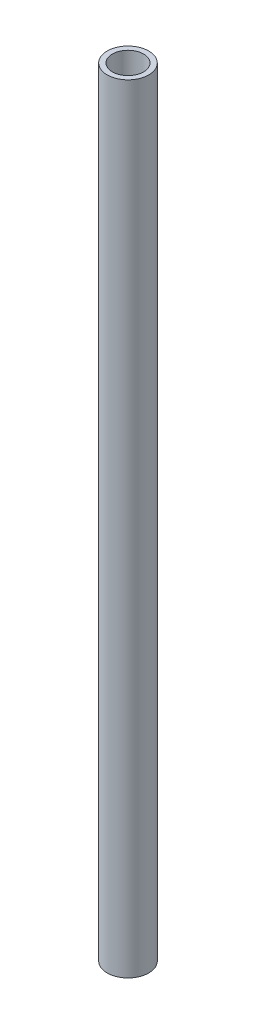
from build123d import *

# Parameters (mm, degrees)
SKETCH2_R   = 4
SKETCH2_R_2 = 3


with BuildPart() as part:
    # Sweep1: sweep along a path in Sketch1
    with BuildLine(Plane.XY) as sweep1_path:
        Line((0, 0), (0, 150))
    # Sketch2 → Sweep1 (sweep)
    with BuildSketch(Plane(origin=(0, 0, 0), x_dir=(1, 0, 0), z_dir=(0, 1, 0))):
        Circle(SKETCH2_R)
        Circle(SKETCH2_R_2, mode=Mode.SUBTRACT)
    sweep(path=sweep1_path.line)


solid = part.part
